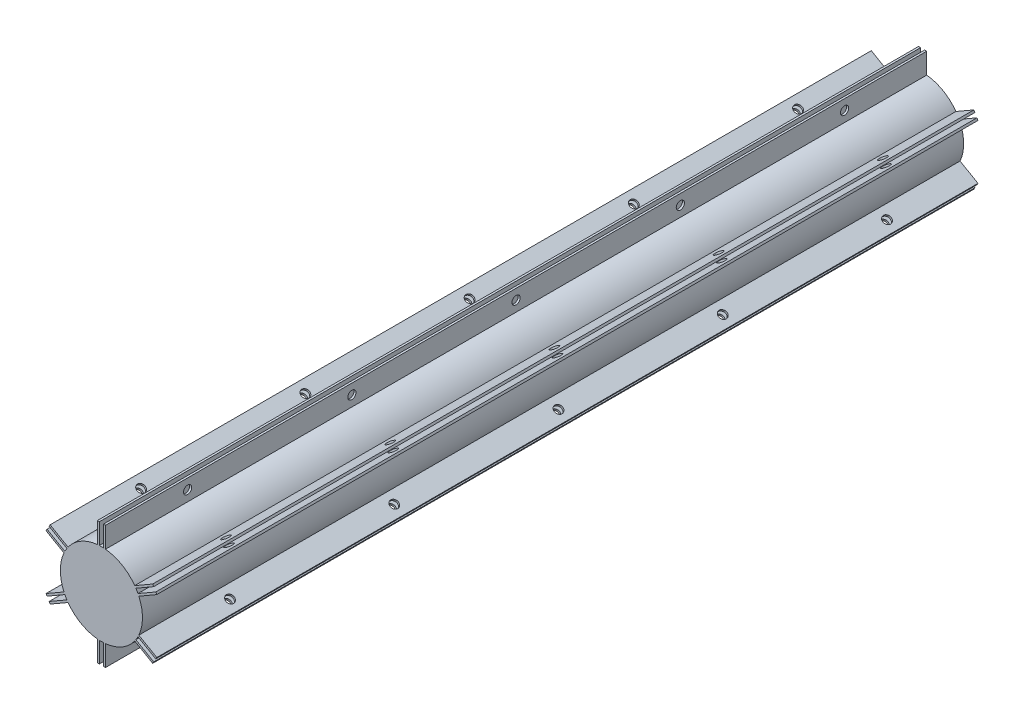
from build123d import *

# Parameters (mm, degrees)
SKETCH1_R           = 10
BOSS_EXTRUDE1_DEPTH = 100
SKETCH4_W           = 0.5
SKETCH4_H           = 15
BOSS_EXTRUDE3_DEPTH = 200
CIRPATTERN7_COUNT   = 6
SKETCH7_R           = 1
CUT_EXTRUDE2_DEPTH  = 5
CIRPATTERN9_COUNT   = 6


with BuildPart() as part:
    # Sketch1 → Boss-Extrude1 (new, symmetric)
    with BuildSketch(Plane.XY):
        Circle(SKETCH1_R)
    extrude(amount=BOSS_EXTRUDE1_DEPTH, both=True)

    # Sketch4 → Boss-Extrude3 (add)
    with BuildSketch(Plane.XY.offset(100)):
        with Locations((-0.75, 7.5)):
            Rectangle(SKETCH4_W, SKETCH4_H)
        with Locations((0.75, 7.5)):
            Rectangle(SKETCH4_W, SKETCH4_H)
    boss_extrude3 = extrude(amount=-BOSS_EXTRUDE3_DEPTH)

    # CirPattern7: Boss-Extrude3 ×6 about axis
    cirpattern7_axis = Axis((0, 0, 0), (0, 0, 1))
    for i in range(1, CIRPATTERN7_COUNT):
        add(boss_extrude3.rotate(cirpattern7_axis, i * 360 / CIRPATTERN7_COUNT))

    # Sketch7 → Cut-Extrude2 (cut)
    with BuildSketch(Plane.ZY.offset(1)):
        with Locations((-80, 12.5)):
            Circle(SKETCH7_R)
        with Locations((-40, 12.5)):
            Circle(SKETCH7_R)
        with Locations((0, 12.5)):
            Circle(SKETCH7_R)
        with Locations((40, 12.5)):
            Circle(SKETCH7_R)
        with Locations((80, 12.5)):
            Circle(SKETCH7_R)
    cut_extrude2 = extrude(amount=-CUT_EXTRUDE2_DEPTH, mode=Mode.SUBTRACT)

    # CirPattern9: Cut-Extrude2 ×6 about axis
    cirpattern9_axis = Axis((0, 0, 100), (0, 0, 1))
    for i in range(1, CIRPATTERN9_COUNT):
        add(cut_extrude2.rotate(cirpattern9_axis, i * 360 / CIRPATTERN9_COUNT), mode=Mode.SUBTRACT)


solid = part.part
